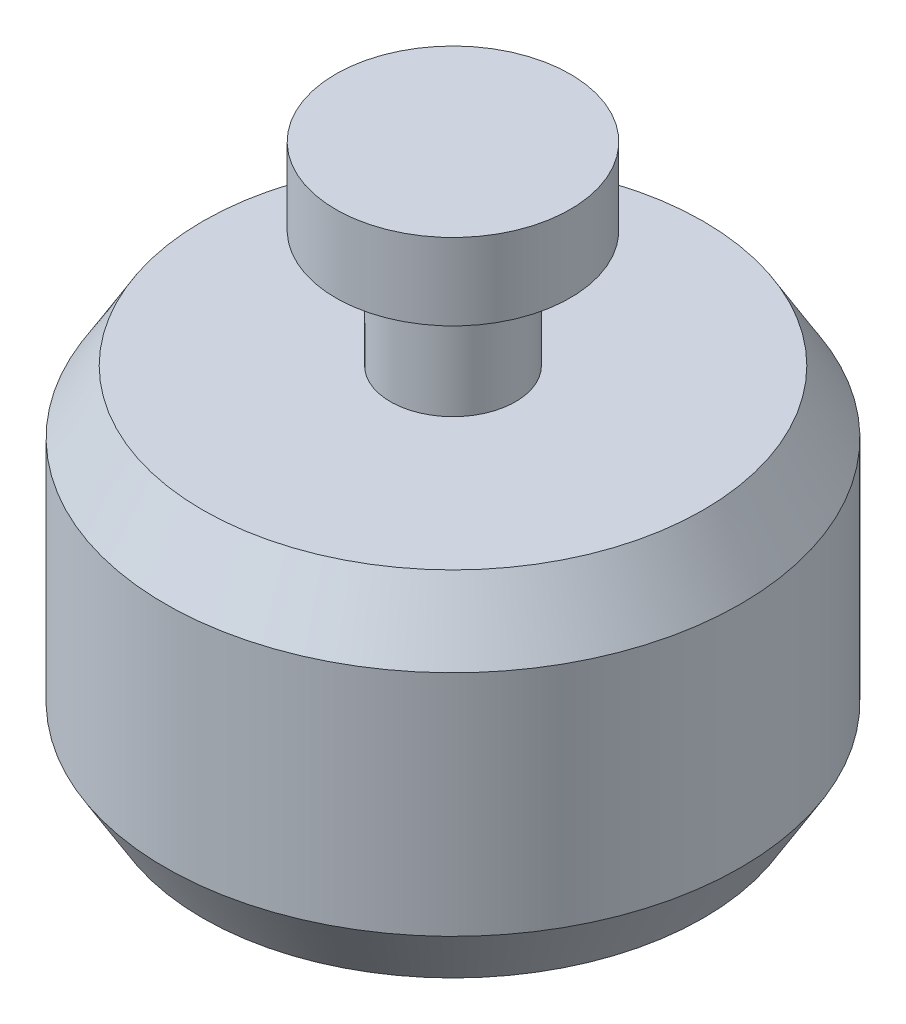
from build123d import *


with BuildPart() as part:
    # Sketch1 → Revolve1 (revolve)
    with BuildSketch(Plane.XY, mode=Mode.PRIVATE) as revolve1_sk:
        Polygon((0, 0), (10.16, 0), (11.684, 2.54), (11.684, 11.811), (10.16, 14.351), (2.54, 14.351), (2.54, 19.1135), (4.7625, 19.1135), (4.7625, 22.225), (0, 22.225), align=None)
    revolve(revolve1_sk.sketch.rotate(Axis((0, 22.225, 0), (0, -1, 0)), 180), axis=Axis((0, 22.225, 0), (0, -1, 0)))


solid = part.part
